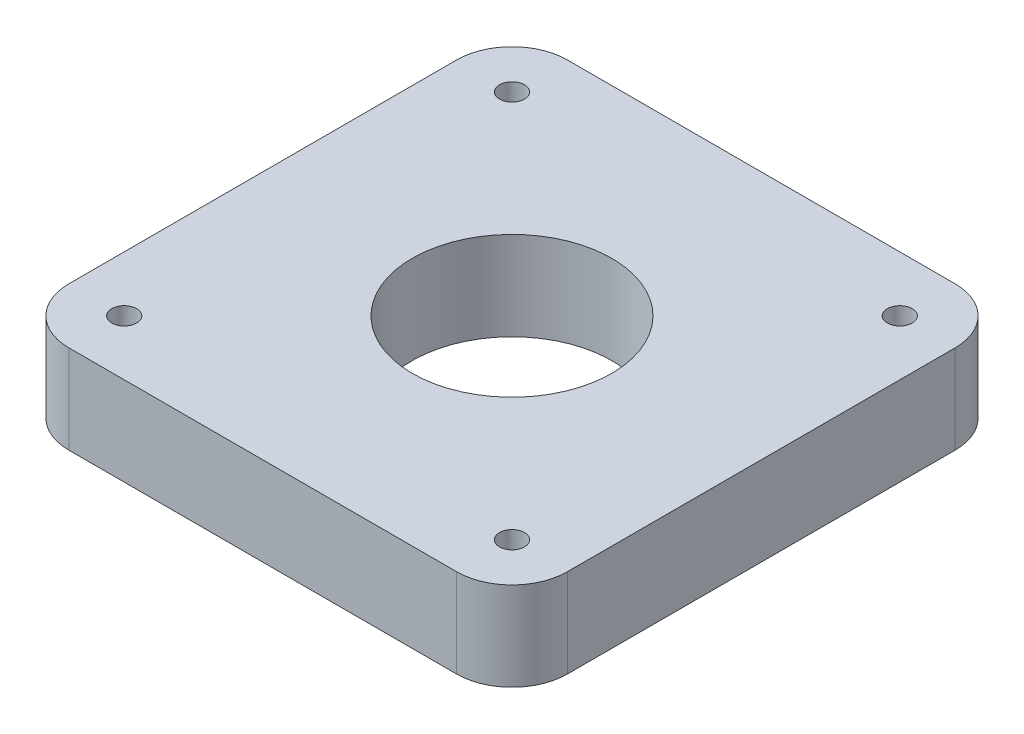
from build123d import *

# Parameters (mm, degrees)
SKETCH1_W           = 45
SKETCH1_H           = 45
SKETCH1_R           = 9
SKETCH1_R_2         = 1.125
BOSS_EXTRUDE1_DEPTH = 8
FILLET1_R           = 5


with BuildPart() as part:
    # Sketch1 → Boss-Extrude1 (new body)
    with BuildSketch(Plane(origin=(0, 0, 0), x_dir=(1, 0, 0), z_dir=(0, 1, 0))):
        Rectangle(SKETCH1_W, SKETCH1_H)
        with Locations(Location((0, 0, 0), (0, 0, 270))):
            Circle(SKETCH1_R, mode=Mode.SUBTRACT)
        with Locations(Location((-17.5, 17.5, 0), (0, 0, 270))):
            Circle(SKETCH1_R_2, mode=Mode.SUBTRACT)
        with Locations(Location((17.5, 17.5, 0), (0, 0, 270))):
            Circle(SKETCH1_R_2, mode=Mode.SUBTRACT)
        with Locations(Location((17.5, -17.5, 0), (0, 0, 270))):
            Circle(SKETCH1_R_2, mode=Mode.SUBTRACT)
        with Locations(Location((-17.5, -17.5, 0), (0, 0, 270))):
            Circle(SKETCH1_R_2, mode=Mode.SUBTRACT)
    extrude(amount=BOSS_EXTRUDE1_DEPTH)

    # Fillet1
    fillet1_edges = [part.edges().sort_by_distance(p)[0] for p in [
        (-22.5, 4, 22.5),
        (-22.5, 4, -22.5),
        (22.5, 4, -22.5),
        (22.5, 4, 22.5),
    ]]
    fillet(fillet1_edges, radius=FILLET1_R)


solid = part.part
